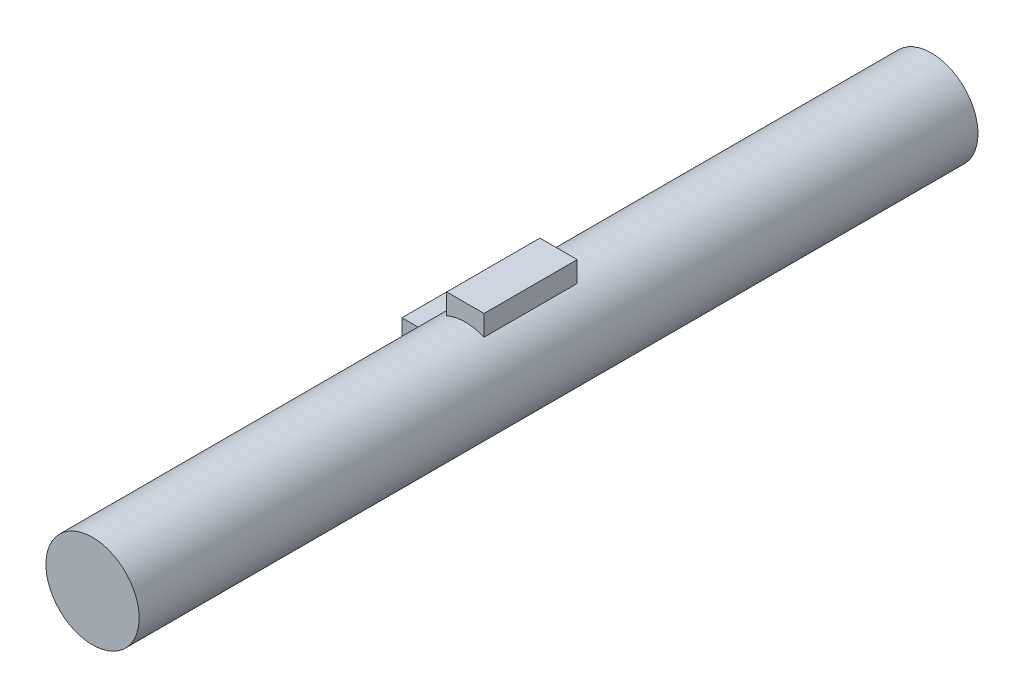
from build123d import *

# Parameters (mm, degrees)
SKETCH2_R           = 5
SKETCH2_W           = 6.8
SKETCH2_H           = 4
SKETCH2_W_2         = 4
SKETCH2_H_2         = 6.8
BOSS_EXTRUDE1_DEPTH = 10
SKETCH2_4_R         = 5
BOSS_EXTRUDE3_DEPTH = 50
BOSS_EXTRUDE4_START = -40
SKETCH2_5_R         = 5
BOSS_EXTRUDE4_DEPTH = 40


with BuildPart() as part:
    # Sketch2 → Boss-Extrude1 (new body)
    with BuildSketch(Plane.XY):
        Circle(SKETCH2_R)
        with Locations((-3.4, 0)):
            Rectangle(SKETCH2_W, SKETCH2_H)
        with Locations((0, 3.4)):
            Rectangle(SKETCH2_W_2, SKETCH2_H_2)
    extrude(amount=BOSS_EXTRUDE1_DEPTH)

    # Sketch2<4> → Boss-Extrude3 (add)
    with BuildSketch(Plane.XY):
        Circle(SKETCH2_4_R)
    extrude(amount=BOSS_EXTRUDE3_DEPTH)

    # Sketch2<5> → Boss-Extrude4 (add)
    with BuildSketch(Plane.XY.offset(BOSS_EXTRUDE4_START)):
        Circle(SKETCH2_5_R)
    extrude(amount=BOSS_EXTRUDE4_DEPTH)


solid = part.part
